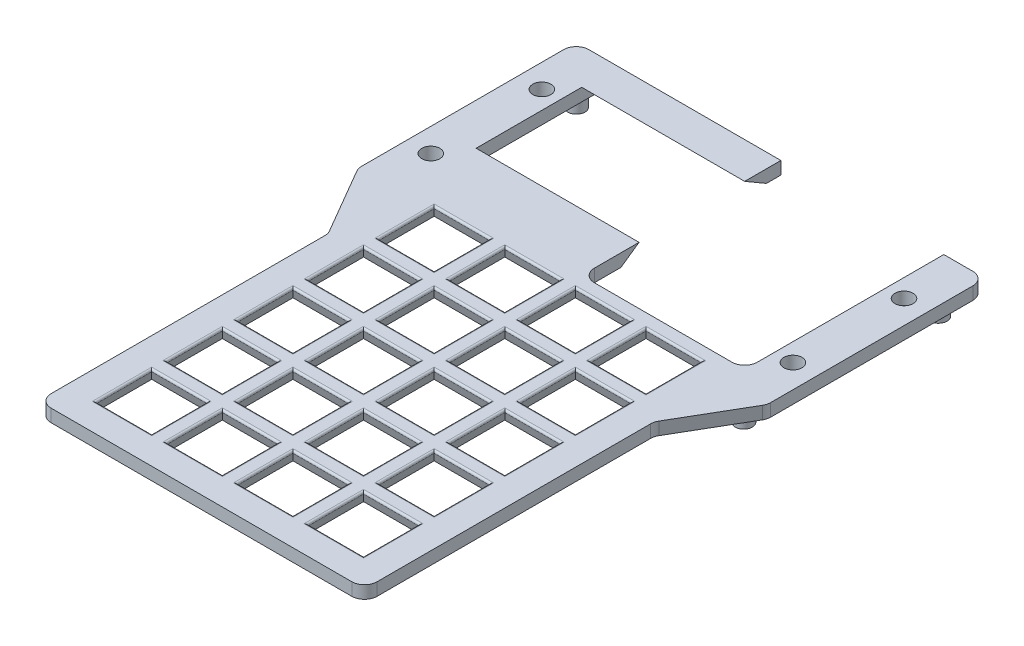
from build123d import *

# Parameters (mm, degrees)
BOSS_EXTRUDE1_DEPTH           = 3.5
SKETCH2_R                     = 2.4
SKETCH2_R_2                   = 2.35
BOSS_EXTRUDE2_DEPTH           = 5.5
SKETCH3_W                     = 45
SKETCH3_H                     = 15.839891038
SKETCH3_H_2                   = 10
SKETCH3_R                     = 2.5
CUT_EXTRUDE1_DEPTH            = 5
SKETCH4_W                     = 15
SKETCH4_H                     = 15
CUT_EXTRUDE2_DEPTH            = 3.5
CUT_EXTRUDE2_DRAFT            = -20
CUT_EXTRUDE2_PROFILE_2_DEPTH  = 3.5
CUT_EXTRUDE2_PROFILE_2_DRAFT  = -20
CUT_EXTRUDE2_PROFILE_3_DEPTH  = 3.5
CUT_EXTRUDE2_PROFILE_3_DRAFT  = -20
CUT_EXTRUDE2_PROFILE_4_DEPTH  = 3.5
CUT_EXTRUDE2_PROFILE_4_DRAFT  = -20
CUT_EXTRUDE2_PROFILE_5_DEPTH  = 3.5
CUT_EXTRUDE2_PROFILE_5_DRAFT  = -20
CUT_EXTRUDE2_PROFILE_6_DEPTH  = 3.5
CUT_EXTRUDE2_PROFILE_6_DRAFT  = -20
CUT_EXTRUDE2_PROFILE_7_DEPTH  = 3.5
CUT_EXTRUDE2_PROFILE_7_DRAFT  = -20
CUT_EXTRUDE2_PROFILE_8_DEPTH  = 3.5
CUT_EXTRUDE2_PROFILE_8_DRAFT  = -20
CUT_EXTRUDE2_PROFILE_9_DEPTH  = 3.5
CUT_EXTRUDE2_PROFILE_9_DRAFT  = -20
CUT_EXTRUDE2_PROFILE_10_DEPTH = 3.5
CUT_EXTRUDE2_PROFILE_10_DRAFT = -20
CUT_EXTRUDE2_PROFILE_11_DEPTH = 3.5
CUT_EXTRUDE2_PROFILE_11_DRAFT = -20
CUT_EXTRUDE2_PROFILE_12_DEPTH = 3.5
CUT_EXTRUDE2_PROFILE_12_DRAFT = -20
CUT_EXTRUDE2_PROFILE_13_DEPTH = 3.5
CUT_EXTRUDE2_PROFILE_13_DRAFT = -20
CUT_EXTRUDE2_PROFILE_14_DEPTH = 3.5
CUT_EXTRUDE2_PROFILE_14_DRAFT = -20
CUT_EXTRUDE2_PROFILE_15_DEPTH = 3.5
CUT_EXTRUDE2_PROFILE_15_DRAFT = -20
CUT_EXTRUDE2_PROFILE_16_DEPTH = 3.5
CUT_EXTRUDE2_PROFILE_16_DRAFT = -20
CUT_EXTRUDE2_PROFILE_17_DEPTH = 3.5
CUT_EXTRUDE2_PROFILE_17_DRAFT = -20
CUT_EXTRUDE2_PROFILE_18_DEPTH = 3.5
CUT_EXTRUDE2_PROFILE_18_DRAFT = -20
CUT_EXTRUDE2_PROFILE_19_DEPTH = 3.5
CUT_EXTRUDE2_PROFILE_19_DRAFT = -20
CUT_EXTRUDE2_PROFILE_20_DEPTH = 3.5
CUT_EXTRUDE2_PROFILE_20_DRAFT = -20
FILLET1_R                     = 3.5
FILLET3_R                     = 0.5
CUT_EXTRUDE3_DEPTH            = 45


with BuildPart() as part:
    # Sketch1 → Boss-Extrude1 (new body)
    with BuildSketch(Plane(origin=(0, 0, 0), x_dir=(1, 0, 0), z_dir=(0, 1, 0))):
        Polygon((-57.597316241, 51.805869074), (-57.597316241, -8.444130926), (-46.097316241, -28.194130926), (-46.097316241, -108.194130926), (43.902683759, -108.194130926), (43.902683759, -28.194130926), (55.402683759, -8.444130926), (55.402683759, 51.805869074), align=None)
    extrude(amount=BOSS_EXTRUDE1_DEPTH)

    # Sketch2 → Boss-Extrude2 (add)
    with BuildSketch(Plane.XZ):
        with Locations(Location((-51.097316241, -45.305869074, 0), (0, 0, 90))):
            Circle(SKETCH2_R)
        with Locations(Location((48.902683759, -45.305869074, 0), (0, 0, 90))):
            Circle(SKETCH2_R)
        with Locations(Location((-31.847316241, -5.130869074, 0), (0, 0, 90))):
            Circle(SKETCH2_R)
        with Locations(Location((-21.847316241, -5.130869074, 0), (0, 0, 90))):
            Circle(SKETCH2_R)
        with Locations(Location((47.402683759, 6.944130926, 0), (0, 0, 90))):
            Circle(SKETCH2_R_2)
        with Locations(Location((-49.597316241, 6.944130926, 0), (0, 0, 90))):
            Circle(SKETCH2_R_2)
    extrude(amount=BOSS_EXTRUDE2_DEPTH)

    # Sketch3 → Cut-Extrude1 (cut)
    with BuildSketch(Plane.XZ):
        Polygon((-1.097316241, -12.645760112), (-46.097316241, -12.645760112), (-46.097316241, -41.805869074), (-1.097316241, -41.805869074), (43.902683759, -41.805869074), (43.902683759, -12.645760112), align=None)
        with Locations((21.402683759, -4.725814593)):
            Rectangle(SKETCH3_W, SKETCH3_H)
        with Locations((21.402683759, -46.805869074)):
            Rectangle(SKETCH3_W, SKETCH3_H_2)
        with Locations(Location((-51.097316241, -35.805869074, 0), (0, 0, 270))):
            Circle(SKETCH3_R)
        with Locations(Location((48.902683759, -35.805869074, 0), (0, 0, 270))):
            Circle(SKETCH3_R)
        with Locations(Location((-51.097316241, -5.130869074, 0), (0, 0, 270))):
            Circle(SKETCH3_R)
        with Locations(Location((48.902683759, -5.130869074, 0), (0, 0, 270))):
            Circle(SKETCH3_R)
    extrude(amount=-CUT_EXTRUDE1_DEPTH, mode=Mode.SUBTRACT)


with BuildPart() as cut_extrude2_tool:
    # Sketch4 → Cut-Extrude2 (with draft: the straight prism first)
    with BuildSketch(Plane.XZ.offset(-3.5)):
        with Locations((-30.347316241, 92.694130926)):
            Rectangle(SKETCH4_W, SKETCH4_H)
    extrude(amount=CUT_EXTRUDE2_DEPTH)
    # Cut-Extrude2: the draft: its side faces are tilted about the plane it starts from
    cut_extrude2_sides = [cut_extrude2_tool.faces().sort_by_distance(p)[0] for p in [
        (-37.847316241, 1.75, 92.694130926),
        (-30.347316241, 1.75, 85.194130926),
        (-22.847316241, 1.75, 92.694130926),
        (-30.347316241, 1.75, 100.194130926),
    ]]
    draft(cut_extrude2_sides, Plane.XZ.offset(-3.5), CUT_EXTRUDE2_DRAFT)


with BuildPart() as part_1:
    add(part.part)

    # Cut-Extrude2: cut by cut_extrude2_tool
    add(cut_extrude2_tool.part, mode=Mode.SUBTRACT)


with BuildPart() as cut_extrude2_profile_2_tool:
    # Sketch4 → Cut-Extrude2 profile 2 (with draft: the straight prism first)
    with BuildSketch(Plane.XZ.offset(-3.5)):
        with Locations((-10.847316241, 92.694130926)):
            Rectangle(SKETCH4_W, SKETCH4_H)
    extrude(amount=CUT_EXTRUDE2_PROFILE_2_DEPTH)
    # Cut-Extrude2 profile 2: the draft: its side faces are tilted about the plane it starts from
    cut_extrude2_profile_2_sides = [cut_extrude2_profile_2_tool.faces().sort_by_distance(p)[0] for p in [
        (-10.847316241, 1.75, 85.194130926),
        (-3.347316241, 1.75, 92.694130926),
        (-10.847316241, 1.75, 100.194130926),
        (-18.347316241, 1.75, 92.694130926),
    ]]
    draft(cut_extrude2_profile_2_sides, Plane.XZ.offset(-3.5), CUT_EXTRUDE2_PROFILE_2_DRAFT)


with BuildPart() as part_2:
    add(part_1.part)

    # Cut-Extrude2 profile 2: cut by cut_extrude2_profile_2_tool
    add(cut_extrude2_profile_2_tool.part, mode=Mode.SUBTRACT)


with BuildPart() as cut_extrude2_profile_3_tool:
    # Sketch4 → Cut-Extrude2 profile 3 (with draft: the straight prism first)
    with BuildSketch(Plane.XZ.offset(-3.5)):
        with Locations((8.652683759, 92.694130926)):
            Rectangle(SKETCH4_W, SKETCH4_H)
    extrude(amount=CUT_EXTRUDE2_PROFILE_3_DEPTH)
    # Cut-Extrude2 profile 3: the draft: its side faces are tilted about the plane it starts from
    cut_extrude2_profile_3_sides = [cut_extrude2_profile_3_tool.faces().sort_by_distance(p)[0] for p in [
        (1.152683759, 1.75, 92.694130926),
        (8.652683759, 1.75, 85.194130926),
        (16.152683759, 1.75, 92.694130926),
        (8.652683759, 1.75, 100.194130926),
    ]]
    draft(cut_extrude2_profile_3_sides, Plane.XZ.offset(-3.5), CUT_EXTRUDE2_PROFILE_3_DRAFT)


with BuildPart() as part_3:
    add(part_2.part)

    # Cut-Extrude2 profile 3: cut by cut_extrude2_profile_3_tool
    add(cut_extrude2_profile_3_tool.part, mode=Mode.SUBTRACT)


with BuildPart() as cut_extrude2_profile_4_tool:
    # Sketch4 → Cut-Extrude2 profile 4 (with draft: the straight prism first)
    with BuildSketch(Plane.XZ.offset(-3.5)):
        with Locations((28.152683759, 92.694130926)):
            Rectangle(SKETCH4_W, SKETCH4_H)
    extrude(amount=CUT_EXTRUDE2_PROFILE_4_DEPTH)
    # Cut-Extrude2 profile 4: the draft: its side faces are tilted about the plane it starts from
    cut_extrude2_profile_4_sides = [cut_extrude2_profile_4_tool.faces().sort_by_distance(p)[0] for p in [
        (20.652683759, 1.75, 92.694130926),
        (28.152683759, 1.75, 85.194130926),
        (35.652683759, 1.75, 92.694130926),
        (28.152683759, 1.75, 100.194130926),
    ]]
    draft(cut_extrude2_profile_4_sides, Plane.XZ.offset(-3.5), CUT_EXTRUDE2_PROFILE_4_DRAFT)


with BuildPart() as part_4:
    add(part_3.part)

    # Cut-Extrude2 profile 4: cut by cut_extrude2_profile_4_tool
    add(cut_extrude2_profile_4_tool.part, mode=Mode.SUBTRACT)


with BuildPart() as cut_extrude2_profile_5_tool:
    # Sketch4 → Cut-Extrude2 profile 5 (with draft: the straight prism first)
    with BuildSketch(Plane.XZ.offset(-3.5)):
        with Locations((-10.847316241, 34.194130926)):
            Rectangle(SKETCH4_W, SKETCH4_H)
    extrude(amount=CUT_EXTRUDE2_PROFILE_5_DEPTH)
    # Cut-Extrude2 profile 5: the draft: its side faces are tilted about the plane it starts from
    cut_extrude2_profile_5_sides = [cut_extrude2_profile_5_tool.faces().sort_by_distance(p)[0] for p in [
        (-18.347316241, 1.75, 34.194130926),
        (-10.847316241, 1.75, 26.694130926),
        (-3.347316241, 1.75, 34.194130926),
        (-10.847316241, 1.75, 41.694130926),
    ]]
    draft(cut_extrude2_profile_5_sides, Plane.XZ.offset(-3.5), CUT_EXTRUDE2_PROFILE_5_DRAFT)


with BuildPart() as part_5:
    add(part_4.part)

    # Cut-Extrude2 profile 5: cut by cut_extrude2_profile_5_tool
    add(cut_extrude2_profile_5_tool.part, mode=Mode.SUBTRACT)


with BuildPart() as cut_extrude2_profile_6_tool:
    # Sketch4 → Cut-Extrude2 profile 6 (with draft: the straight prism first)
    with BuildSketch(Plane.XZ.offset(-3.5)):
        with Locations((-30.347316241, 73.194130926)):
            Rectangle(SKETCH4_W, SKETCH4_H)
    extrude(amount=CUT_EXTRUDE2_PROFILE_6_DEPTH)
    # Cut-Extrude2 profile 6: the draft: its side faces are tilted about the plane it starts from
    cut_extrude2_profile_6_sides = [cut_extrude2_profile_6_tool.faces().sort_by_distance(p)[0] for p in [
        (-37.847316241, 1.75, 73.194130926),
        (-30.347316241, 1.75, 65.694130926),
        (-22.847316241, 1.75, 73.194130926),
        (-30.347316241, 1.75, 80.694130926),
    ]]
    draft(cut_extrude2_profile_6_sides, Plane.XZ.offset(-3.5), CUT_EXTRUDE2_PROFILE_6_DRAFT)


with BuildPart() as part_6:
    add(part_5.part)

    # Cut-Extrude2 profile 6: cut by cut_extrude2_profile_6_tool
    add(cut_extrude2_profile_6_tool.part, mode=Mode.SUBTRACT)


with BuildPart() as cut_extrude2_profile_7_tool:
    # Sketch4 → Cut-Extrude2 profile 7 (with draft: the straight prism first)
    with BuildSketch(Plane.XZ.offset(-3.5)):
        with Locations((-10.847316241, 73.194130926)):
            Rectangle(SKETCH4_W, SKETCH4_H)
    extrude(amount=CUT_EXTRUDE2_PROFILE_7_DEPTH)
    # Cut-Extrude2 profile 7: the draft: its side faces are tilted about the plane it starts from
    cut_extrude2_profile_7_sides = [cut_extrude2_profile_7_tool.faces().sort_by_distance(p)[0] for p in [
        (-18.347316241, 1.75, 73.194130926),
        (-10.847316241, 1.75, 65.694130926),
        (-3.347316241, 1.75, 73.194130926),
        (-10.847316241, 1.75, 80.694130926),
    ]]
    draft(cut_extrude2_profile_7_sides, Plane.XZ.offset(-3.5), CUT_EXTRUDE2_PROFILE_7_DRAFT)


with BuildPart() as part_7:
    add(part_6.part)

    # Cut-Extrude2 profile 7: cut by cut_extrude2_profile_7_tool
    add(cut_extrude2_profile_7_tool.part, mode=Mode.SUBTRACT)


with BuildPart() as cut_extrude2_profile_8_tool:
    # Sketch4 → Cut-Extrude2 profile 8 (with draft: the straight prism first)
    with BuildSketch(Plane.XZ.offset(-3.5)):
        with Locations((8.652683759, 73.194130926)):
            Rectangle(SKETCH4_W, SKETCH4_H)
    extrude(amount=CUT_EXTRUDE2_PROFILE_8_DEPTH)
    # Cut-Extrude2 profile 8: the draft: its side faces are tilted about the plane it starts from
    cut_extrude2_profile_8_sides = [cut_extrude2_profile_8_tool.faces().sort_by_distance(p)[0] for p in [
        (1.152683759, 1.75, 73.194130926),
        (8.652683759, 1.75, 65.694130926),
        (16.152683759, 1.75, 73.194130926),
        (8.652683759, 1.75, 80.694130926),
    ]]
    draft(cut_extrude2_profile_8_sides, Plane.XZ.offset(-3.5), CUT_EXTRUDE2_PROFILE_8_DRAFT)


with BuildPart() as part_8:
    add(part_7.part)

    # Cut-Extrude2 profile 8: cut by cut_extrude2_profile_8_tool
    add(cut_extrude2_profile_8_tool.part, mode=Mode.SUBTRACT)


with BuildPart() as cut_extrude2_profile_9_tool:
    # Sketch4 → Cut-Extrude2 profile 9 (with draft: the straight prism first)
    with BuildSketch(Plane.XZ.offset(-3.5)):
        with Locations((28.152683759, 73.194130926)):
            Rectangle(SKETCH4_W, SKETCH4_H)
    extrude(amount=CUT_EXTRUDE2_PROFILE_9_DEPTH)
    # Cut-Extrude2 profile 9: the draft: its side faces are tilted about the plane it starts from
    cut_extrude2_profile_9_sides = [cut_extrude2_profile_9_tool.faces().sort_by_distance(p)[0] for p in [
        (20.652683759, 1.75, 73.194130926),
        (28.152683759, 1.75, 65.694130926),
        (35.652683759, 1.75, 73.194130926),
        (28.152683759, 1.75, 80.694130926),
    ]]
    draft(cut_extrude2_profile_9_sides, Plane.XZ.offset(-3.5), CUT_EXTRUDE2_PROFILE_9_DRAFT)


with BuildPart() as part_9:
    add(part_8.part)

    # Cut-Extrude2 profile 9: cut by cut_extrude2_profile_9_tool
    add(cut_extrude2_profile_9_tool.part, mode=Mode.SUBTRACT)


with BuildPart() as cut_extrude2_profile_10_tool:
    # Sketch4 → Cut-Extrude2 profile 10 (with draft: the straight prism first)
    with BuildSketch(Plane.XZ.offset(-3.5)):
        with Locations((-30.347316241, 53.694130926)):
            Rectangle(SKETCH4_W, SKETCH4_H)
    extrude(amount=CUT_EXTRUDE2_PROFILE_10_DEPTH)
    # Cut-Extrude2 profile 10: the draft: its side faces are tilted about the plane it starts from
    cut_extrude2_profile_10_sides = [cut_extrude2_profile_10_tool.faces().sort_by_distance(p)[0] for p in [
        (-37.847316241, 1.75, 53.694130926),
        (-30.347316241, 1.75, 46.194130926),
        (-22.847316241, 1.75, 53.694130926),
        (-30.347316241, 1.75, 61.194130926),
    ]]
    draft(cut_extrude2_profile_10_sides, Plane.XZ.offset(-3.5), CUT_EXTRUDE2_PROFILE_10_DRAFT)


with BuildPart() as part_10:
    add(part_9.part)

    # Cut-Extrude2 profile 10: cut by cut_extrude2_profile_10_tool
    add(cut_extrude2_profile_10_tool.part, mode=Mode.SUBTRACT)


with BuildPart() as cut_extrude2_profile_11_tool:
    # Sketch4 → Cut-Extrude2 profile 11 (with draft: the straight prism first)
    with BuildSketch(Plane.XZ.offset(-3.5)):
        with Locations((-10.847316241, 53.694130926)):
            Rectangle(SKETCH4_W, SKETCH4_H)
    extrude(amount=CUT_EXTRUDE2_PROFILE_11_DEPTH)
    # Cut-Extrude2 profile 11: the draft: its side faces are tilted about the plane it starts from
    cut_extrude2_profile_11_sides = [cut_extrude2_profile_11_tool.faces().sort_by_distance(p)[0] for p in [
        (-18.347316241, 1.75, 53.694130926),
        (-10.847316241, 1.75, 46.194130926),
        (-3.347316241, 1.75, 53.694130926),
        (-10.847316241, 1.75, 61.194130926),
    ]]
    draft(cut_extrude2_profile_11_sides, Plane.XZ.offset(-3.5), CUT_EXTRUDE2_PROFILE_11_DRAFT)


with BuildPart() as part_11:
    add(part_10.part)

    # Cut-Extrude2 profile 11: cut by cut_extrude2_profile_11_tool
    add(cut_extrude2_profile_11_tool.part, mode=Mode.SUBTRACT)


with BuildPart() as cut_extrude2_profile_12_tool:
    # Sketch4 → Cut-Extrude2 profile 12 (with draft: the straight prism first)
    with BuildSketch(Plane.XZ.offset(-3.5)):
        with Locations((8.652683759, 53.694130926)):
            Rectangle(SKETCH4_W, SKETCH4_H)
    extrude(amount=CUT_EXTRUDE2_PROFILE_12_DEPTH)
    # Cut-Extrude2 profile 12: the draft: its side faces are tilted about the plane it starts from
    cut_extrude2_profile_12_sides = [cut_extrude2_profile_12_tool.faces().sort_by_distance(p)[0] for p in [
        (1.152683759, 1.75, 53.694130926),
        (8.652683759, 1.75, 46.194130926),
        (16.152683759, 1.75, 53.694130926),
        (8.652683759, 1.75, 61.194130926),
    ]]
    draft(cut_extrude2_profile_12_sides, Plane.XZ.offset(-3.5), CUT_EXTRUDE2_PROFILE_12_DRAFT)


with BuildPart() as part_12:
    add(part_11.part)

    # Cut-Extrude2 profile 12: cut by cut_extrude2_profile_12_tool
    add(cut_extrude2_profile_12_tool.part, mode=Mode.SUBTRACT)


with BuildPart() as cut_extrude2_profile_13_tool:
    # Sketch4 → Cut-Extrude2 profile 13 (with draft: the straight prism first)
    with BuildSketch(Plane.XZ.offset(-3.5)):
        with Locations((28.152683759, 53.694130926)):
            Rectangle(SKETCH4_W, SKETCH4_H)
    extrude(amount=CUT_EXTRUDE2_PROFILE_13_DEPTH)
    # Cut-Extrude2 profile 13: the draft: its side faces are tilted about the plane it starts from
    cut_extrude2_profile_13_sides = [cut_extrude2_profile_13_tool.faces().sort_by_distance(p)[0] for p in [
        (20.652683759, 1.75, 53.694130926),
        (28.152683759, 1.75, 46.194130926),
        (35.652683759, 1.75, 53.694130926),
        (28.152683759, 1.75, 61.194130926),
    ]]
    draft(cut_extrude2_profile_13_sides, Plane.XZ.offset(-3.5), CUT_EXTRUDE2_PROFILE_13_DRAFT)


with BuildPart() as part_13:
    add(part_12.part)

    # Cut-Extrude2 profile 13: cut by cut_extrude2_profile_13_tool
    add(cut_extrude2_profile_13_tool.part, mode=Mode.SUBTRACT)


with BuildPart() as cut_extrude2_profile_14_tool:
    # Sketch4 → Cut-Extrude2 profile 14 (with draft: the straight prism first)
    with BuildSketch(Plane.XZ.offset(-3.5)):
        with Locations((-30.347316241, 34.194130926)):
            Rectangle(SKETCH4_W, SKETCH4_H)
    extrude(amount=CUT_EXTRUDE2_PROFILE_14_DEPTH)
    # Cut-Extrude2 profile 14: the draft: its side faces are tilted about the plane it starts from
    cut_extrude2_profile_14_sides = [cut_extrude2_profile_14_tool.faces().sort_by_distance(p)[0] for p in [
        (-37.847316241, 1.75, 34.194130926),
        (-30.347316241, 1.75, 26.694130926),
        (-22.847316241, 1.75, 34.194130926),
        (-30.347316241, 1.75, 41.694130926),
    ]]
    draft(cut_extrude2_profile_14_sides, Plane.XZ.offset(-3.5), CUT_EXTRUDE2_PROFILE_14_DRAFT)


with BuildPart() as part_14:
    add(part_13.part)

    # Cut-Extrude2 profile 14: cut by cut_extrude2_profile_14_tool
    add(cut_extrude2_profile_14_tool.part, mode=Mode.SUBTRACT)


with BuildPart() as cut_extrude2_profile_15_tool:
    # Sketch4 → Cut-Extrude2 profile 15 (with draft: the straight prism first)
    with BuildSketch(Plane.XZ.offset(-3.5)):
        with Locations((8.652683759, 34.194130926)):
            Rectangle(SKETCH4_W, SKETCH4_H)
    extrude(amount=CUT_EXTRUDE2_PROFILE_15_DEPTH)
    # Cut-Extrude2 profile 15: the draft: its side faces are tilted about the plane it starts from
    cut_extrude2_profile_15_sides = [cut_extrude2_profile_15_tool.faces().sort_by_distance(p)[0] for p in [
        (1.152683759, 1.75, 34.194130926),
        (8.652683759, 1.75, 26.694130926),
        (16.152683759, 1.75, 34.194130926),
        (8.652683759, 1.75, 41.694130926),
    ]]
    draft(cut_extrude2_profile_15_sides, Plane.XZ.offset(-3.5), CUT_EXTRUDE2_PROFILE_15_DRAFT)


with BuildPart() as part_15:
    add(part_14.part)

    # Cut-Extrude2 profile 15: cut by cut_extrude2_profile_15_tool
    add(cut_extrude2_profile_15_tool.part, mode=Mode.SUBTRACT)


with BuildPart() as cut_extrude2_profile_16_tool:
    # Sketch4 → Cut-Extrude2 profile 16 (with draft: the straight prism first)
    with BuildSketch(Plane.XZ.offset(-3.5)):
        with Locations((28.152683759, 34.194130926)):
            Rectangle(SKETCH4_W, SKETCH4_H)
    extrude(amount=CUT_EXTRUDE2_PROFILE_16_DEPTH)
    # Cut-Extrude2 profile 16: the draft: its side faces are tilted about the plane it starts from
    cut_extrude2_profile_16_sides = [cut_extrude2_profile_16_tool.faces().sort_by_distance(p)[0] for p in [
        (20.652683759, 1.75, 34.194130926),
        (28.152683759, 1.75, 26.694130926),
        (35.652683759, 1.75, 34.194130926),
        (28.152683759, 1.75, 41.694130926),
    ]]
    draft(cut_extrude2_profile_16_sides, Plane.XZ.offset(-3.5), CUT_EXTRUDE2_PROFILE_16_DRAFT)


with BuildPart() as part_16:
    add(part_15.part)

    # Cut-Extrude2 profile 16: cut by cut_extrude2_profile_16_tool
    add(cut_extrude2_profile_16_tool.part, mode=Mode.SUBTRACT)


with BuildPart() as cut_extrude2_profile_17_tool:
    # Sketch4 → Cut-Extrude2 profile 17 (with draft: the straight prism first)
    with BuildSketch(Plane.XZ.offset(-3.5)):
        with Locations((-30.347316241, 14.694130926)):
            Rectangle(SKETCH4_W, SKETCH4_H)
    extrude(amount=CUT_EXTRUDE2_PROFILE_17_DEPTH)
    # Cut-Extrude2 profile 17: the draft: its side faces are tilted about the plane it starts from
    cut_extrude2_profile_17_sides = [cut_extrude2_profile_17_tool.faces().sort_by_distance(p)[0] for p in [
        (-37.847316241, 1.75, 14.694130926),
        (-30.347316241, 1.75, 7.194130926),
        (-22.847316241, 1.75, 14.694130926),
        (-30.347316241, 1.75, 22.194130926),
    ]]
    draft(cut_extrude2_profile_17_sides, Plane.XZ.offset(-3.5), CUT_EXTRUDE2_PROFILE_17_DRAFT)


with BuildPart() as part_17:
    add(part_16.part)

    # Cut-Extrude2 profile 17: cut by cut_extrude2_profile_17_tool
    add(cut_extrude2_profile_17_tool.part, mode=Mode.SUBTRACT)


with BuildPart() as cut_extrude2_profile_18_tool:
    # Sketch4 → Cut-Extrude2 profile 18 (with draft: the straight prism first)
    with BuildSketch(Plane.XZ.offset(-3.5)):
        with Locations((-10.847316241, 14.694130926)):
            Rectangle(SKETCH4_W, SKETCH4_H)
    extrude(amount=CUT_EXTRUDE2_PROFILE_18_DEPTH)
    # Cut-Extrude2 profile 18: the draft: its side faces are tilted about the plane it starts from
    cut_extrude2_profile_18_sides = [cut_extrude2_profile_18_tool.faces().sort_by_distance(p)[0] for p in [
        (-18.347316241, 1.75, 14.694130926),
        (-10.847316241, 1.75, 7.194130926),
        (-3.347316241, 1.75, 14.694130926),
        (-10.847316241, 1.75, 22.194130926),
    ]]
    draft(cut_extrude2_profile_18_sides, Plane.XZ.offset(-3.5), CUT_EXTRUDE2_PROFILE_18_DRAFT)


with BuildPart() as part_18:
    add(part_17.part)

    # Cut-Extrude2 profile 18: cut by cut_extrude2_profile_18_tool
    add(cut_extrude2_profile_18_tool.part, mode=Mode.SUBTRACT)


with BuildPart() as cut_extrude2_profile_19_tool:
    # Sketch4 → Cut-Extrude2 profile 19 (with draft: the straight prism first)
    with BuildSketch(Plane.XZ.offset(-3.5)):
        with Locations((8.652683759, 14.694130926)):
            Rectangle(SKETCH4_W, SKETCH4_H)
    extrude(amount=CUT_EXTRUDE2_PROFILE_19_DEPTH)
    # Cut-Extrude2 profile 19: the draft: its side faces are tilted about the plane it starts from
    cut_extrude2_profile_19_sides = [cut_extrude2_profile_19_tool.faces().sort_by_distance(p)[0] for p in [
        (1.152683759, 1.75, 14.694130926),
        (8.652683759, 1.75, 7.194130926),
        (16.152683759, 1.75, 14.694130926),
        (8.652683759, 1.75, 22.194130926),
    ]]
    draft(cut_extrude2_profile_19_sides, Plane.XZ.offset(-3.5), CUT_EXTRUDE2_PROFILE_19_DRAFT)


with BuildPart() as part_19:
    add(part_18.part)

    # Cut-Extrude2 profile 19: cut by cut_extrude2_profile_19_tool
    add(cut_extrude2_profile_19_tool.part, mode=Mode.SUBTRACT)


with BuildPart() as cut_extrude2_profile_20_tool:
    # Sketch4 → Cut-Extrude2 profile 20 (with draft: the straight prism first)
    with BuildSketch(Plane.XZ.offset(-3.5)):
        with Locations((28.152683759, 14.694130926)):
            Rectangle(SKETCH4_W, SKETCH4_H)
    extrude(amount=CUT_EXTRUDE2_PROFILE_20_DEPTH)
    # Cut-Extrude2 profile 20: the draft: its side faces are tilted about the plane it starts from
    cut_extrude2_profile_20_sides = [cut_extrude2_profile_20_tool.faces().sort_by_distance(p)[0] for p in [
        (20.652683759, 1.75, 14.694130926),
        (28.152683759, 1.75, 7.194130926),
        (35.652683759, 1.75, 14.694130926),
        (28.152683759, 1.75, 22.194130926),
    ]]
    draft(cut_extrude2_profile_20_sides, Plane.XZ.offset(-3.5), CUT_EXTRUDE2_PROFILE_20_DRAFT)


with BuildPart() as part_20:
    add(part_19.part)

    # Cut-Extrude2 profile 20: cut by cut_extrude2_profile_20_tool
    add(cut_extrude2_profile_20_tool.part, mode=Mode.SUBTRACT)

    # Fillet1
    fillet1_edges = [part_20.edges().sort_by_distance(p)[0] for p in [
        (43.902683759, 1.75, 3.194130926),
        (-1.097316241, 1.75, 3.194130926),
        (55.402683759, 1.75, 8.444130926),
        (43.902683759, 1.75, 28.194130926),
        (43.902683759, 1.75, 108.194130926),
        (-46.097316241, 1.75, 108.194130926),
        (-46.097316241, 1.75, 28.194130926),
        (-57.597316241, 1.75, 8.444130926),
        (-57.597316241, 1.75, -51.805869074),
        (55.402683759, 1.75, -51.805869074),
    ]]
    fillet(fillet1_edges, radius=FILLET1_R)

    # Fillet3
    fillet3_edges = [part_20.edges().sort_by_distance(p)[0] for p in [
        (-30.347316241, 3.5, 41.694130926),
        (-22.847316241, 3.5, 34.194130926),
        (-30.347316241, 3.5, 26.694130926),
        (-37.847316241, 3.5, 34.194130926),
        (28.152683759, 3.5, 61.194130926),
        (35.652683759, 3.5, 53.694130926),
        (28.152683759, 3.5, 46.194130926),
        (20.652683759, 3.5, 53.694130926),
        (8.652683759, 3.5, 61.194130926),
        (16.152683759, 3.5, 53.694130926),
        (8.652683759, 3.5, 46.194130926),
        (1.152683759, 3.5, 53.694130926),
        (-10.847316241, 3.5, 61.194130926),
        (-3.347316241, 3.5, 53.694130926),
        (-10.847316241, 3.5, 46.194130926),
        (-18.347316241, 3.5, 53.694130926),
        (-30.347316241, 3.5, 22.194130926),
        (-22.847316241, 3.5, 14.694130926),
        (-30.347316241, 3.5, 7.194130926),
        (-37.847316241, 3.5, 14.694130926),
        (28.152683759, 3.5, 41.694130926),
        (35.652683759, 3.5, 34.194130926),
        (28.152683759, 3.5, 26.694130926),
        (20.652683759, 3.5, 34.194130926),
        (8.652683759, 3.5, 41.694130926),
        (16.152683759, 3.5, 34.194130926),
        (8.652683759, 3.5, 26.694130926),
        (1.152683759, 3.5, 34.194130926),
        (-10.847316241, 3.5, 41.694130926),
        (-3.347316241, 3.5, 34.194130926),
        (-10.847316241, 3.5, 26.694130926),
        (-18.347316241, 3.5, 34.194130926),
        (-10.847316241, 3.5, 80.694130926),
        (-3.347316241, 3.5, 73.194130926),
        (-10.847316241, 3.5, 65.694130926),
        (-18.347316241, 3.5, 73.194130926),
        (28.152683759, 3.5, 100.194130926),
        (35.652683759, 3.5, 92.694130926),
        (28.152683759, 3.5, 85.194130926),
        (20.652683759, 3.5, 92.694130926),
        (8.652683759, 3.5, 100.194130926),
        (16.152683759, 3.5, 92.694130926),
        (8.652683759, 3.5, 85.194130926),
        (1.152683759, 3.5, 92.694130926),
        (-10.847316241, 3.5, 100.194130926),
        (-3.347316241, 3.5, 92.694130926),
        (-10.847316241, 3.5, 85.194130926),
        (-18.347316241, 3.5, 92.694130926),
        (-30.347316241, 3.5, 61.194130926),
        (-22.847316241, 3.5, 53.694130926),
        (-30.347316241, 3.5, 46.194130926),
        (-37.847316241, 3.5, 53.694130926),
        (28.152683759, 3.5, 80.694130926),
        (35.652683759, 3.5, 73.194130926),
        (28.152683759, 3.5, 65.694130926),
        (20.652683759, 3.5, 73.194130926),
        (8.652683759, 3.5, 80.694130926),
        (16.152683759, 3.5, 73.194130926),
        (8.652683759, 3.5, 65.694130926),
        (1.152683759, 3.5, 73.194130926),
        (-30.347316241, 3.5, 80.694130926),
        (-22.847316241, 3.5, 73.194130926),
        (-30.347316241, 3.5, 65.694130926),
        (-37.847316241, 3.5, 73.194130926),
        (-10.847316241, 3.5, 22.194130926),
        (-3.347316241, 3.5, 14.694130926),
        (-10.847316241, 3.5, 7.194130926),
        (-18.347316241, 3.5, 14.694130926),
        (8.652683759, 3.5, 22.194130926),
        (16.152683759, 3.5, 14.694130926),
        (8.652683759, 3.5, 7.194130926),
        (1.152683759, 3.5, 14.694130926),
        (28.152683759, 3.5, 22.194130926),
        (35.652683759, 3.5, 14.694130926),
        (28.152683759, 3.5, 7.194130926),
        (20.652683759, 3.5, 14.694130926),
        (-30.347316241, 3.5, 100.194130926),
        (-22.847316241, 3.5, 92.694130926),
        (-30.347316241, 3.5, 85.194130926),
        (-37.847316241, 3.5, 92.694130926),
    ]]
    fillet(fillet3_edges, radius=FILLET3_R)

    # Sketch5 → Cut-Extrude3 (cut)
    with BuildSketch(Plane(origin=(-1.097316241, 0, 0), x_dir=(0, 0, -1), z_dir=(1, 0, 0))):
        Polygon((41.805869074, 3.5), (47.805869074, 0), (41.805869074, 0), align=None)
        Polygon((12.645760112, 3.5), (7.645760112, 0), (12.645760112, 0), align=None)
    extrude(amount=-CUT_EXTRUDE3_DEPTH, mode=Mode.SUBTRACT)


solid = part_20.part
